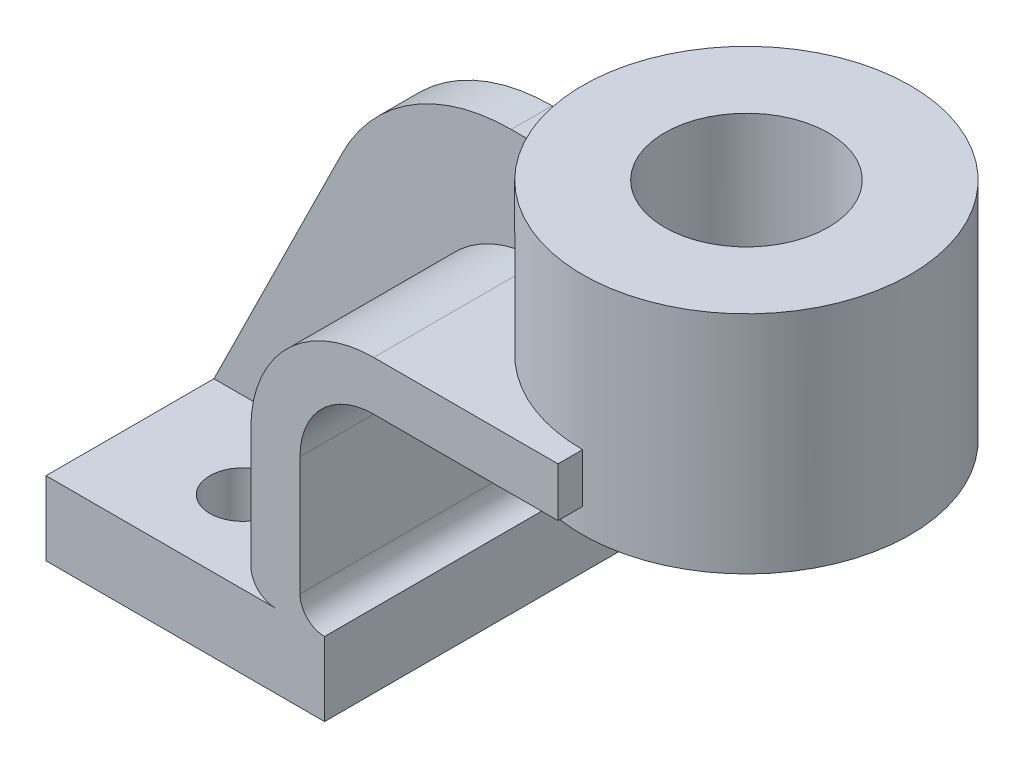
from build123d import *

# Parameters (mm, degrees)
BOSS_EXTRUDE1_DEPTH = 92
BOSS_EXTRUDE2_START = -18
SKETCH2_R           = 40
SKETCH2_R_2         = 20
BOSS_EXTRUDE2_DEPTH = 55
SKETCH3_R           = 8
CUT_EXTRUDE1_DEPTH  = 18
BOSS_EXTRUDE3_START = -46
BOSS_EXTRUDE3_DEPTH = 5
FILLET1_R           = 46


with BuildPart() as part:
    # Sketch1 → Boss-Extrude1 (new body)
    with BuildSketch(Plane.XY):
        with BuildLine():
            Line((-6, 53), (-6, 24))
            ThreePointArc((-6, 24), (-4.242640687, 19.757359313), (0, 18))
            Line((0, 18), (0, 0))
            Line((0, 0), (-68, 0))
            Line((-68, 0), (-68, 18))
            Line((-68, 18), (-12, 18))
            ThreePointArc((-12, 18), (-16.242640687, 19.757359313), (-18, 24))
            Line((-18, 24), (-18, 53))
            ThreePointArc((-18, 53), (-9.213203436, 74.213203436), (12, 83))
            Line((12, 83), (57, 83))
            Line((57, 83), (57, 71))
            Line((57, 71), (12, 71))
            ThreePointArc((12, 71), (-0.727922061, 65.727922061), (-6, 53))
        make_face()
    extrude(amount=-BOSS_EXTRUDE1_DEPTH)

    # Sketch2 → Boss-Extrude2 (add)
    with BuildSketch(Plane(origin=(0, 83, 0), x_dir=(1, 0, 0), z_dir=(0, 1, 0)).offset(BOSS_EXTRUDE2_START)):
        with Locations(Location((57, 46, 0), (0, 0, 90))):
            Circle(SKETCH2_R)
        with Locations(Location((57, 46, 0), (0, 0, 90))):
            Circle(SKETCH2_R_2, mode=Mode.SUBTRACT)
    extrude(amount=BOSS_EXTRUDE2_DEPTH)

    # Sketch3 → Cut-Extrude1 (cut)
    with BuildSketch(Plane(origin=(0, 18, 0), x_dir=(1, 0, 0), z_dir=(0, 1, 0))):
        with Locations(Location((-40, 20, 0), (0, 0, 270))):
            Circle(SKETCH3_R)
        with Locations(Location((-40, 72, 0), (0, 0, 270))):
            Circle(SKETCH3_R)
    extrude(amount=-CUT_EXTRUDE1_DEPTH, mode=Mode.SUBTRACT)

    # Sketch4 → Boss-Extrude3 (add, symmetric)
    with BuildSketch(Plane.XY.offset(BOSS_EXTRUDE3_START)):
        with BuildLine():
            ThreePointArc((-18, 53), (-9.213203436, 74.213203436), (12, 83))
            Line((12, 83), (17, 83))
            Line((17, 83), (18, 83))
            Line((18, 83), (18, 107))
            Line((18, 107), (-24, 107))
            Line((-24, 107), (-68, 18))
            Line((-68, 18), (-12, 18))
            ThreePointArc((-12, 18), (-16.242640687, 19.757359313), (-18, 24))
            Line((-18, 24), (-18, 53))
        make_face()
    extrude(amount=BOSS_EXTRUDE3_DEPTH, both=True)

    # Fillet1
    fillet1_edges = [part.edges().sort_by_distance(p)[0] for p in [
        (-24, 107, -46),
    ]]
    fillet(fillet1_edges, radius=FILLET1_R)


solid = part.part
